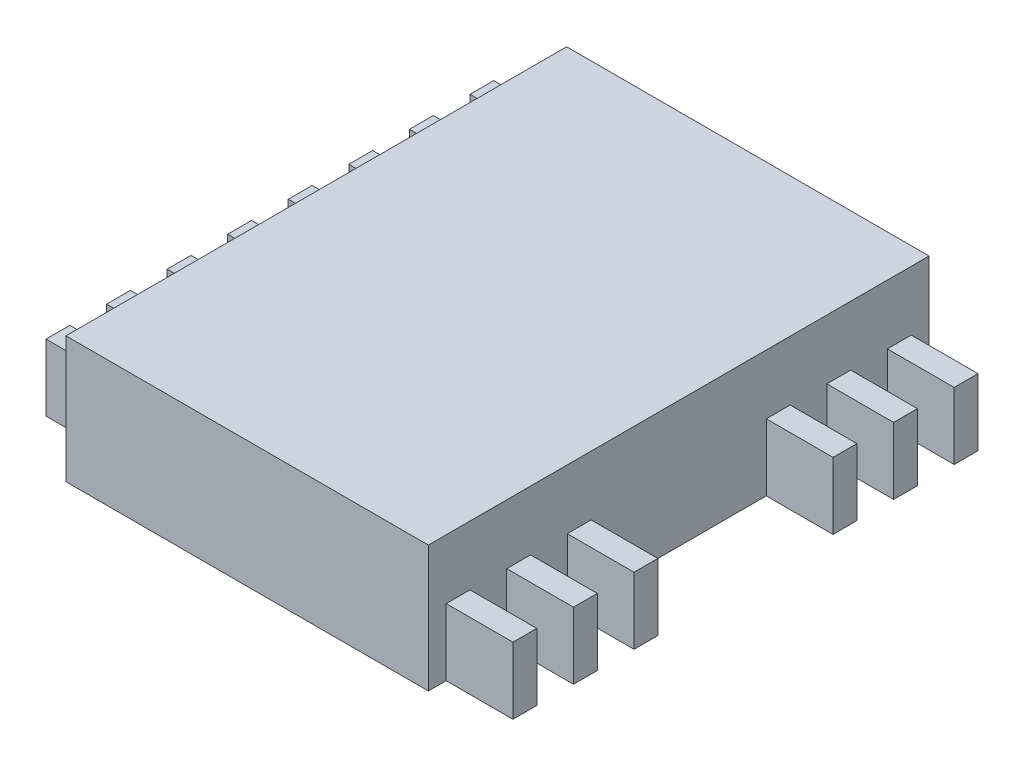
from build123d import *

# Parameters (mm, degrees)
SKETCH1_W           = 7.6
SKETCH1_H           = 10.5
BOSS_EXTRUDE1_DEPTH = 2.65
SKETCH2_W           = 0.5
SKETCH2_H           = 1.4
BOSS_EXTRUDE2_DEPTH = 1.4
SKETCH4_W           = 0.5
SKETCH4_H           = 1.4
BOSS_EXTRUDE3_DEPTH = 1.4


with BuildPart() as part:
    # Sketch1 → Boss-Extrude1 (new body)
    with BuildSketch(Plane(origin=(0, 0, 0), x_dir=(1, 0, 0), z_dir=(0, 1, 0))):
        Rectangle(SKETCH1_W, SKETCH1_H)
    extrude(amount=BOSS_EXTRUDE1_DEPTH)

    # Sketch2 → Boss-Extrude2 (add)
    with BuildSketch(Plane.ZY.offset(3.8)):
        with Locations((-4.871874673, 0.7)):
            Rectangle(SKETCH2_W, SKETCH2_H)
        with Locations((-3.601874673, 0.7)):
            Rectangle(SKETCH2_W, SKETCH2_H)
        with Locations((-2.331874673, 0.7)):
            Rectangle(SKETCH2_W, SKETCH2_H)
        with Locations((-1.061874673, 0.7)):
            Rectangle(SKETCH2_W, SKETCH2_H)
        with Locations((0.208125327, 0.7)):
            Rectangle(SKETCH2_W, SKETCH2_H)
        with Locations((1.478125327, 0.7)):
            Rectangle(SKETCH2_W, SKETCH2_H)
        with Locations((2.748125327, 0.7)):
            Rectangle(SKETCH2_W, SKETCH2_H)
        with Locations((4.018125327, 0.7)):
            Rectangle(SKETCH2_W, SKETCH2_H)
    extrude(amount=BOSS_EXTRUDE2_DEPTH)

    # Sketch4 → Boss-Extrude3 (add)
    with BuildSketch(Plane(origin=(3.8, 0, 0), x_dir=(0, 0, -1), z_dir=(1, 0, 0))):
        with Locations((-4.626381769, 0.7)):
            Rectangle(SKETCH4_W, SKETCH4_H)
        with Locations((-3.356381769, 0.7)):
            Rectangle(SKETCH4_W, SKETCH4_H)
        with Locations((-2.086381769, 0.7)):
            Rectangle(SKETCH4_W, SKETCH4_H)
        with Locations((2.086381769, 0.7)):
            Rectangle(SKETCH4_W, SKETCH4_H)
        with Locations((3.356381769, 0.7)):
            Rectangle(SKETCH4_W, SKETCH4_H)
        with Locations((4.626381769, 0.7)):
            Rectangle(SKETCH4_W, SKETCH4_H)
    extrude(amount=BOSS_EXTRUDE3_DEPTH)


solid = part.part
